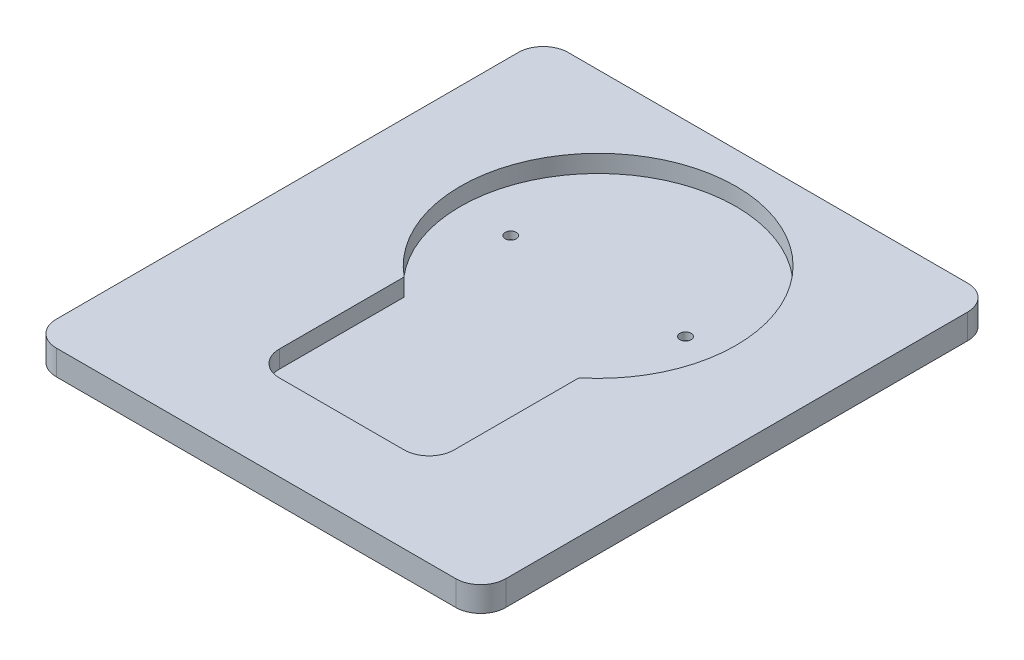
from build123d import *

# Parameters (mm, degrees)
BOSS_EXTRU_1_DEPTH      = 10
ENL_V_MAT_EXTRU_1_DEPTH = 7
D_GAGEMENT_M41_D        = 4.5
D_GAGEMENT_M41_DEPTH    = 10
D_GAGEMENT_M41_TIP      = 1.351936393


with BuildPart() as part:
    # Esquisse2 → Boss.-Extru.1 (new body)
    with BuildSketch(Plane(origin=(0, 0, 0), x_dir=(1, 0, 0), z_dir=(0, 1, 0))):
        with BuildLine():
            Line((-80, 102.5), (80, 102.5))
            ThreePointArc((80, 102.5), (87.071067812, 99.571067812), (90, 92.5))
            Line((90, 92.5), (90, -92.5))
            ThreePointArc((90, -92.5), (87.071067812, -99.571067812), (80, -102.5))
            Line((80, -102.5), (-80, -102.5))
            ThreePointArc((-80, -102.5), (-87.071067812, -99.571067812), (-90, -92.5))
            Line((-90, -92.5), (-90, 92.5))
            ThreePointArc((-90, 92.5), (-87.071067812, 99.571067812), (-80, 102.5))
        make_face()
    extrude(amount=BOSS_EXTRU_1_DEPTH)

    # Esquisse3 → Enlèv. mat.-Extru.1 (cut)
    with BuildSketch(Plane(origin=(0, 10, 0), x_dir=(1, 0, 0), z_dir=(0, 1, 0))):
        with BuildLine():
            Line((-35, -8.185360488), (-35, -58.185360488))
            ThreePointArc((-35, -58.185360488), (-32.071067812, -65.2564283), (-25, -68.185360488))
            Line((-25, -68.185360488), (25, -68.185360488))
            ThreePointArc((25, -68.185360488), (32.071067812, -65.2564283), (35, -58.185360488))
            Line((35, -58.185360488), (35, -8.185360488))
            ThreePointArc((35, -8.185360488), (0, 89.7), (-35, -8.185360488))
        make_face()
    extrude(amount=-ENL_V_MAT_EXTRU_1_DEPTH, mode=Mode.SUBTRACT)

    # Dégagement M41
    with Locations(Plane(origin=(0, 0, 0), x_dir=(-1, 0, 0), z_dir=(0, -1, 0))):
        with Locations((35, 34.5), (-35, 34.5)):
            Hole(D_GAGEMENT_M41_D / 2, depth=D_GAGEMENT_M41_DEPTH)
            with Locations((0, 0, -(D_GAGEMENT_M41_DEPTH + D_GAGEMENT_M41_TIP / 2))):  # 118° drill point
                Cone(0, D_GAGEMENT_M41_D / 2, D_GAGEMENT_M41_TIP, mode=Mode.SUBTRACT)


solid = part.part
